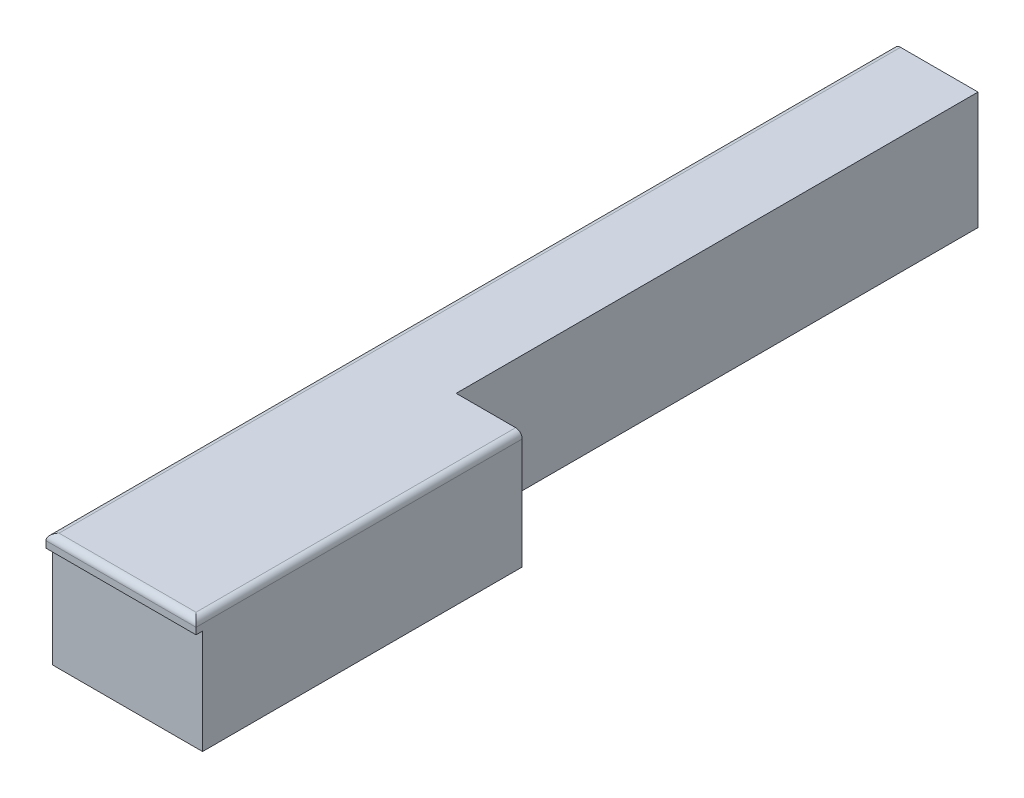
from build123d import *

# Parameters (mm, degrees)
SALIENTE_EXTRUIR1_DEPTH = 18
CROQUIS3_W              = 23
CROQUIS3_H              = 16
CORTAR_EXTRUIR1_DEPTH   = 1
REDONDEO4_R             = 1


with BuildPart() as part:
    # Croquis2 → Saliente-Extruir1 (new body)
    with BuildSketch(Plane(origin=(0, 0, 0), x_dir=(1, 0, 0), z_dir=(0, 1, 0))):
        Polygon((0, 130), (0, 0), (23, 0), (23, 50), (12.875, 50), (12.875, 130), align=None)
    extrude(amount=SALIENTE_EXTRUIR1_DEPTH)

    # Croquis3 → Cortar-Extruir1 (cut)
    with BuildSketch(Plane.XY):
        with Locations((11.5, 8)):
            Rectangle(CROQUIS3_W, CROQUIS3_H)
    extrude(amount=-CORTAR_EXTRUIR1_DEPTH, mode=Mode.SUBTRACT)

    # Redondeo4
    redondeo4_edges = [part.edges().sort_by_distance(p)[0] for p in [
        (0, 18, -65),
        (11.5, 18, 0),
        (23, 18, -25),
    ]]
    fillet(redondeo4_edges, radius=REDONDEO4_R)


solid = part.part
